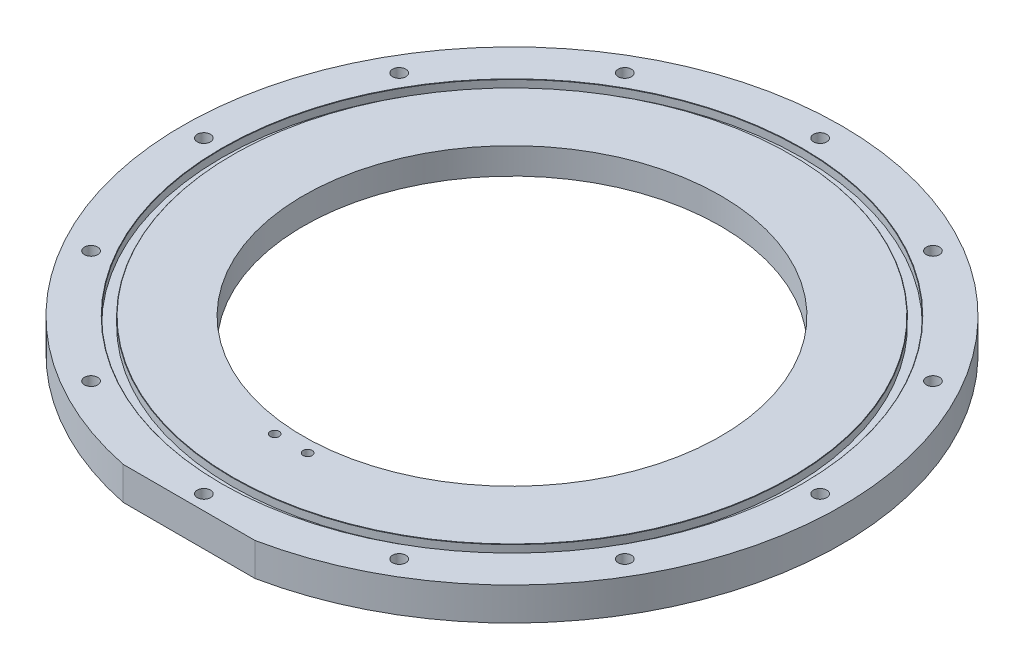
from build123d import *

# Parameters (mm, degrees)
F_1_4_20_TAPPED_HOLE1_D = 5.1054
SKETCH4_W               = 4.064
SKETCH4_H               = 3.0734
CHAMFER1_SIZE           = 0.127
F_8_32_TAPPED_HOLE1_D   = 3.4544
CUT_EXTRUDE1_REACH      = 182.054
SKETCH7_W               = 50.8
SKETCH7_H               = 2.565921067


with BuildPart() as part:
    # Sketch1 → Revolve1 (revolve)
    with BuildSketch(Plane.XY, mode=Mode.PRIVATE) as revolve1_sk:
        Polygon((109.7915, 0), (109.7915, 2.54), (105.7783, 2.54), (80.3783, 2.54), (80.3783, 12.7), (105.7783, 12.7), (127, 12.7), (127, 0), align=None)
    revolve(revolve1_sk.sketch.rotate(Axis((0, 0, 0), (0, 1, 0)), 90), axis=Axis((0, 0, 0), (0, 1, 0)))

    # 1/4-20 Tapped Hole1 (through all)
    with Locations(Plane(origin=(0, 12.7, 0), x_dir=(1, 0, 0), z_dir=(0, 1, 0))):
        with Locations((0, 118.745), (59.3725, 102.836186572), (102.836186572, 59.3725), (118.745, 0), (102.836186572, -59.3725), (59.3725, -102.836186572), (0, -118.745), (-59.3725, -102.836186572), (-102.836186572, -59.3725), (-118.745, 0), (-102.836186572, 59.3725), (-59.3725, 102.836186572)):
            Hole(F_1_4_20_TAPPED_HOLE1_D / 2)

    # Sketch4 → Cut-Revolve1 (revolve, cut)
    with BuildSketch(Plane.XY, mode=Mode.PRIVATE) as cut_revolve1_sk:
        with Locations((109.7788, 11.1633)):
            Rectangle(SKETCH4_W, SKETCH4_H)
    revolve(cut_revolve1_sk.sketch.rotate(Axis((0, 12.7, 0), (0, -1, 0)), 90), axis=Axis((0, 12.7, 0), (0, -1, 0)), mode=Mode.SUBTRACT)

    # Chamfer1
    chamfer1_edges = [part.edges().sort_by_distance(p)[0] for p in [
        (0, 12.7, -107.7468),
        (0, 12.7, -111.8108),
    ]]
    chamfer(chamfer1_edges, length=CHAMFER1_SIZE)

    # #8-32 Tapped Hole1 (through all)
    with Locations(Plane(origin=(0, 2.54, 0), x_dir=(-1, 0, 0), z_dir=(0, -1, 0))):
        with Locations((6.35, -85.09), (-6.35, -85.09)):
            Hole(F_8_32_TAPPED_HOLE1_D / 2)

    # Sketch7 → Cut-Extrude1 (cut, up to next)
    with BuildSketch(Plane(origin=(0, 12.7, 0), x_dir=(1, 0, 0), z_dir=(0, 1, 0)), mode=Mode.PRIVATE) as cut_extrude1_sk1:
        with Locations((0, -125.717039467)):
            Rectangle(SKETCH7_W, SKETCH7_H)
    cut_extrude1_tool1 = extrude(cut_extrude1_sk1.sketch, amount=-CUT_EXTRUDE1_REACH, mode=Mode.PRIVATE) & part.part
    add(cut_extrude1_tool1.solids().sort_by_distance((0, 12.7, 125.717039))[0], mode=Mode.SUBTRACT)


solid = part.part
